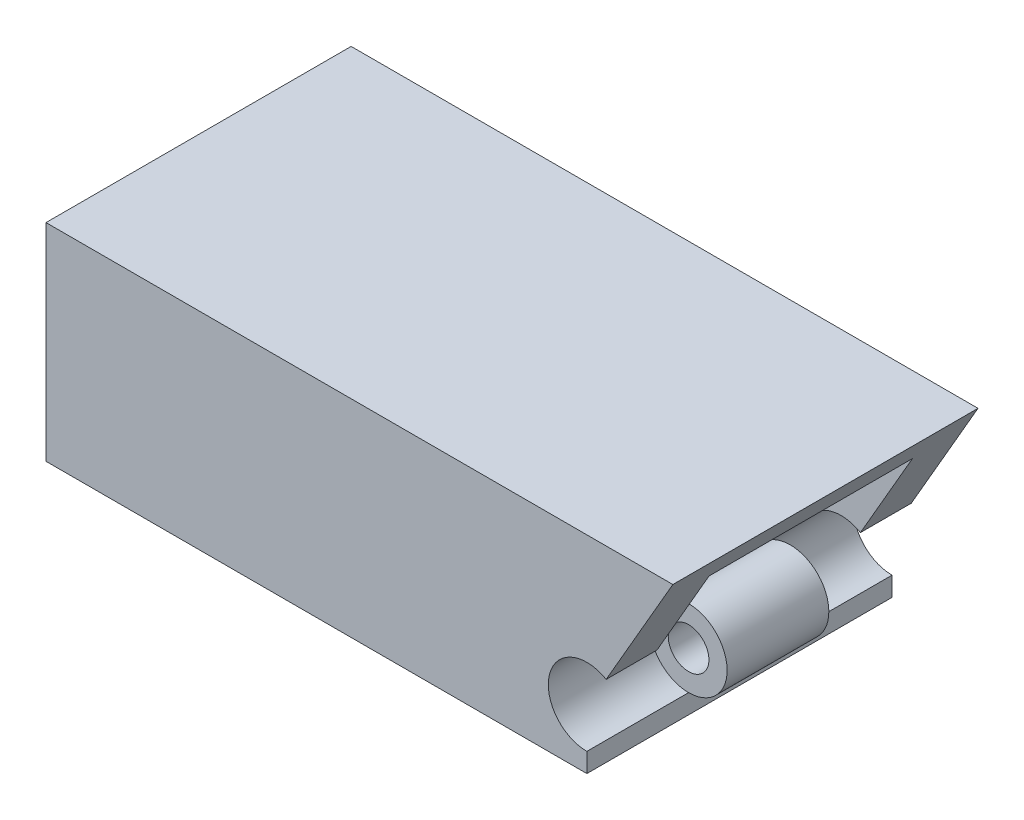
from build123d import *

# Parameters (mm, degrees)
SKETCH_1_R          = 2
EXTRUDE_1_DEPTH     = 30
SKETCH_2_W          = 20
SKETCH_2_H          = 9.5
CUT_EXTRUDE_1_DEPTH = 70.293872581
EXTRUDE_START       = -30
SKETCH_3_R          = 3.79021957
SKETCH_3_R_2        = 2
EXTRUDE_2_DEPTH     = 30
CUT_EXTRUDE_START   = -10
SKETCH_4_R          = 3.79021957
SKETCH_4_R_2        = 2
CUT_EXTRUDE_2_DEPTH = 10
SKETCH_5_R          = 3.79021957
SKETCH_5_R_2        = 2
CUT_EXTRUDE_3_DEPTH = 10
SKETCH_6_W          = 20
SKETCH_6_H          = 8.329300022
CUT_EXTRUDE_4_DEPTH = 40


with BuildPart() as part:
    # 스케치1 → 보스-돌출1 (new body)
    # profile 1 of 6: a face of its own
    with BuildSketch(Plane.XY):
        with BuildLine():
            Line((-13.8475309, -1.196894222), (-7.287940278, 10.164650011))
            Line((-7.287940278, 10.164650011), (-37.287940278, 10.164650011))
            Line((-37.287940278, 10.164650011), (-37.287940278, -10.164650011))
            Line((-37.287940278, -10.164650011), (-15.742640685, -10.164650011))
            Line((-15.742640685, -10.164650011), (-15.742640685, -8.269540226))
            ThreePointArc((-15.742640685, -8.269540226), (-19.403711655, -3.498339646), (-13.8475309, -1.196894222))
        make_face()
    # profile 2 of 6: a face of its own
    with BuildSketch(Plane.XY):
        with BuildLine():
            ThreePointArc((-15.742640685, -8.269540226), (-12.081569715, -5.460301666), (-13.8475309, -1.196894222))
            ThreePointArc((-13.8475309, -1.196894222), (-19.403711655, -3.498339646), (-15.742640685, -8.269540226))
        make_face()
        with Locations((-15.742640685, -4.479320656)):
            Circle(SKETCH_1_R, mode=Mode.SUBTRACT)
    # profile 3 of 6: a face of its own
    with BuildSketch(Plane.XY):
        with Locations((-15.742640685, -4.479320656)):
            Circle(SKETCH_1_R)
    # profile 4 of 6: a face of its own
    with BuildSketch(Plane.XY):
        with BuildLine():
            Line((-7.287940278, -10.164650011), (-7.287940278, 10.164650011))
            Line((-7.287940278, 10.164650011), (-13.8475309, -1.196894222))
            ThreePointArc((-13.8475309, -1.196894222), (-12.081569715, -5.460301666), (-15.742640685, -8.269540226))
            Line((-15.742640685, -8.269540226), (-15.742640685, -10.164650011))
            Line((-15.742640685, -10.164650011), (-7.287940278, -10.164650011))
        make_face()
    # profile 5 of 6: a face of its own
    with BuildSketch(Plane.XY):
        with BuildLine():
            Line((7.433176247, 10.164650011), (-7.287940278, 10.164650011))
            Line((-7.287940278, 10.164650011), (-7.287940278, -10.164650011))
            Line((-7.287940278, -10.164650011), (15.887876654, -10.164650011))
            Line((15.887876654, -10.164650011), (15.887876654, -8.269540226))
            ThreePointArc((15.887876654, -8.269540226), (19.548947624, -5.460301666), (17.782986439, -1.196894222))
            ThreePointArc((17.782986439, -1.196894222), (15.887876654, -0.689101086), (13.992766869, -1.196894222))
            Line((13.992766869, -1.196894222), (7.433176247, 10.164650011))
        make_face()
        with Locations((15.887876654, -4.479320656)):
            Circle(SKETCH_1_R, mode=Mode.SUBTRACT)
    # profile 6 of 6: a face of its own
    with BuildSketch(Plane.XY):
        with BuildLine():
            Line((24.342577061, 10.164650011), (7.433176247, 10.164650011))
            Line((7.433176247, 10.164650011), (13.992766869, -1.196894222))
            ThreePointArc((13.992766869, -1.196894222), (15.887876654, -0.689101086), (17.782986439, -1.196894222))
            Line((17.782986439, -1.196894222), (24.342577061, 10.164650011))
        make_face()
    extrude(amount=EXTRUDE_1_DEPTH)

    # 스케치2 → 컷-돌출1 (cut, through all)
    with BuildSketch(Plane.ZY.offset(37.287940278)):
        with Locations((15, 2.914650011)):
            Rectangle(SKETCH_2_W, SKETCH_2_H)
    extrude(amount=-CUT_EXTRUDE_1_DEPTH, mode=Mode.SUBTRACT)

    # 스케치3 → 보스-돌출2 (add)
    with BuildSketch(Plane.XY.offset(30).offset(EXTRUDE_START)):
        with Locations((15.887876654, -4.479320656)):
            Circle(SKETCH_3_R)
        with Locations((15.887876654, -4.479320656)):
            Circle(SKETCH_3_R_2, mode=Mode.SUBTRACT)
    extrude(amount=EXTRUDE_2_DEPTH)

    # 스케치4 → 컷-돌출2 (cut)
    with BuildSketch(Plane.XY.offset(30).offset(CUT_EXTRUDE_START)):
        with Locations((15.887876654, -4.479320656)):
            Circle(SKETCH_4_R)
        with Locations((15.887876654, -4.479320656)):
            Circle(SKETCH_4_R_2, mode=Mode.SUBTRACT)
    extrude(amount=CUT_EXTRUDE_2_DEPTH, mode=Mode.SUBTRACT)

    # 스케치5 → 컷-돌출3 (cut)
    with BuildSketch(Plane(origin=(0, 0, 0), x_dir=(-1, 0, 0), z_dir=(0, 0, -1))):
        with Locations((-15.887876654, -4.479320656)):
            Circle(SKETCH_5_R)
        with Locations((-15.887876654, -4.479320656)):
            Circle(SKETCH_5_R_2, mode=Mode.SUBTRACT)
    extrude(amount=-CUT_EXTRUDE_3_DEPTH, mode=Mode.SUBTRACT)

    # 스케치6 → 컷-돌출4 (cut)
    with BuildSketch(Plane.ZY.offset(37.287940278)):
        with Locations((15, -6)):
            Rectangle(SKETCH_6_W, SKETCH_6_H)
    extrude(amount=-CUT_EXTRUDE_4_DEPTH, mode=Mode.SUBTRACT)


solid = part.part
